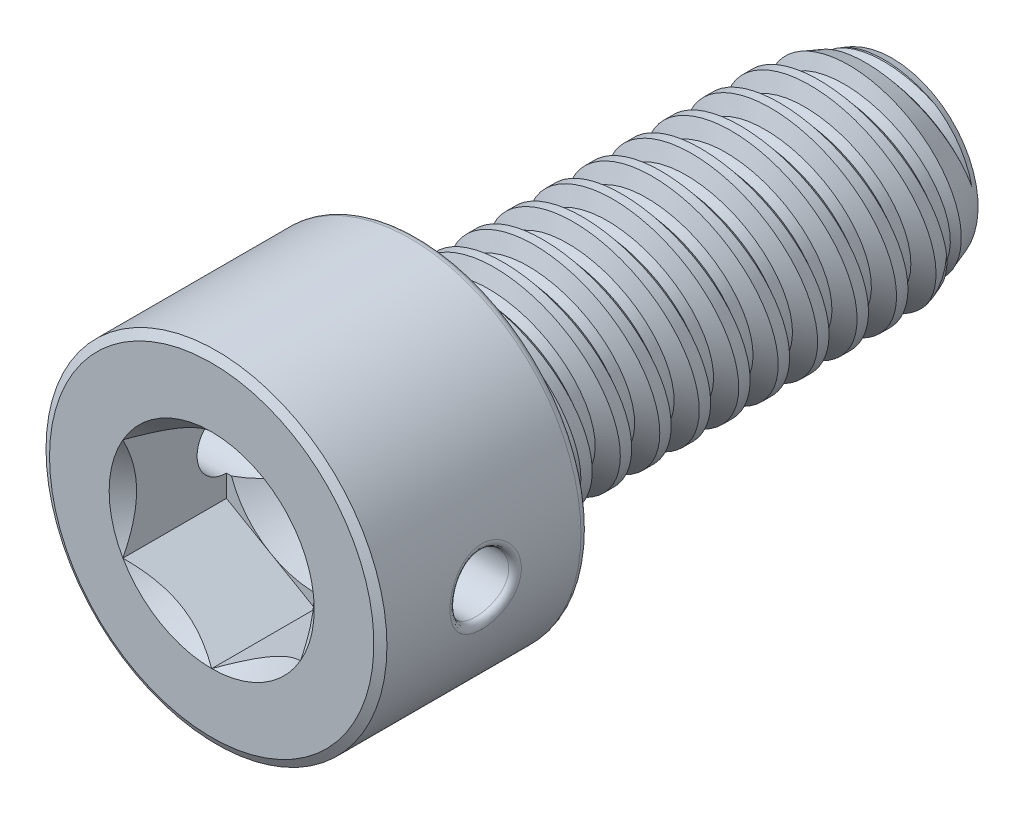
from build123d import *

# Parameters (mm, degrees)
SKETCH1_W               = 9.525
SKETCH1_H               = 2.0828
LPATTERN1_COUNT         = 12
LPATTERN1_PITCH         = 0.79375
LPATTERN2_COUNT         = 2
LPATTERN2_PITCH         = 0.79375
SKETCH4_R               = 3.429
EXTRUDE1_DEPTH          = 4.1656
CUT_EXTRUDE6_DEPTH      = 11.688391315
CUT_EXTRUDE6_DEPTH_BACK = 11.688391315
SKETCH9_R               = 0.59055
FILLET1_R               = 0.166624
CHAMFER1_SIZE           = 0.166624
CHAMFER1_SIZE2          = 0.096200411
CUT_EXTRUDE1_DEPTH      = 2.0828
SKETCH8_R               = 1.7859375
CUT_EXTRUDE5_DEPTH      = 0.694266667
CUT_EXTRUDE5_DRAFT      = -60
FILLET2_R               = 0.127


with BuildPart() as part:
    # Sketch1 → Revolve1 (revolve)
    with BuildSketch(Plane(origin=(0, 0, 0), x_dir=(0, 0, -1), z_dir=(1, 0, 0))):
        with Locations((4.7625, 1.0414)):
            Rectangle(SKETCH1_W, SKETCH1_H)
    revolve(axis=Axis((0, 0, 0), (0, 0, 1)))

    # Sketch2 → Cut-Revolve1 (revolve, cut)
    with BuildSketch(Plane(origin=(0, 0, 0), x_dir=(0, 0, -1), z_dir=(1, 0, 0)), mode=Mode.PRIVATE) as cut_revolve1_sk:
        Polygon((0.097465104, 2.101371857), (0.779720832, 2.231374854), (0.61647657, 1.762908932), (0.421546362, 1.725765218), align=None)
    cut_revolve1 = revolve(cut_revolve1_sk.sketch.rotate(Axis((0, -0.162231854, 0), (0, 0.18718091792156116, -0.9823254572523517)), 180), axis=Axis((0, -0.162231854, 0), (0, 0.18718091792156116, -0.9823254572523517)), mode=Mode.SUBTRACT)

    # Sketch3 → Cut-Revolve2 (revolve, cut)
    with BuildSketch(Plane(origin=(0, 0, 0), x_dir=(0, 0, -1), z_dir=(1, 0, 0))):
        Polygon((9.525, 1.725765218), (8.544055, 2.0828), (9.525, 2.0828), align=None)
    revolve(axis=Axis((0, 0, -8.544055), (0, 0, 1)), mode=Mode.SUBTRACT)

    # LPattern1: Cut-Revolve1 ×12
    with Locations(*[(0, 0, -i * LPATTERN1_PITCH) for i in range(1, LPATTERN1_COUNT)]):
        add(cut_revolve1, mode=Mode.SUBTRACT)

    # LPattern2: Cut-Revolve1 ×2
    with Locations(*[(0, 0, i * LPATTERN2_PITCH) for i in range(1, LPATTERN2_COUNT)]):
        add(cut_revolve1, mode=Mode.SUBTRACT)

    # Sketch4 → Extrude1 (add)
    with BuildSketch(Plane.XY):
        Circle(SKETCH4_R)
    extrude(amount=EXTRUDE1_DEPTH)

    # Sketch9 → Cut-Extrude6 (cut, two sides: drawn at the far end of the back side and taken through both)
    with BuildSketch(Plane(origin=(0, 0, 0), x_dir=(0, 0, -1), z_dir=(1, 0, 0)).offset(-CUT_EXTRUDE6_DEPTH_BACK)):
        with Locations(Location((-2.0828, 0, 0), (0, 0, 180))):
            Circle(SKETCH9_R)
    extrude(amount=CUT_EXTRUDE6_DEPTH + CUT_EXTRUDE6_DEPTH_BACK, mode=Mode.SUBTRACT)

    # Fillet1
    fillet1_edges = [part.edges().sort_by_distance(p)[0] for p in [
        (-3.429, 0, 0),
    ]]
    fillet(fillet1_edges, radius=FILLET1_R)

    # Chamfer1
    chamfer1_edges = [part.edges().sort_by_distance(p)[0] for p in [
        (-3.429, 0, 4.1656),
    ]]
    chamfer1_side = [part.faces().sort_by_distance(p)[0] for p in [
        (0, 0, 4.1656),
    ]]
    chamfer(chamfer1_edges, length=CHAMFER1_SIZE, length2=CHAMFER1_SIZE2, reference=chamfer1_side[0])

    # Sketch6 → Cut-Extrude1 (cut)
    with BuildSketch(Plane.XY.offset(4.1656)):
        Polygon((0, -2.062222993), (1.7859375, -1.031111496), (1.7859375, 1.031111496), (0, 2.062222993), (-1.7859375, 1.031111496), (-1.7859375, -1.031111496), align=None)
    extrude(amount=-CUT_EXTRUDE1_DEPTH, mode=Mode.SUBTRACT)

    # Cut-Extrude4 cone 1 section (through the dimple's axis) → Cut-Extrude4 (revolve, cut)
    with BuildSketch(Plane(origin=(0, 0, 4.1656), x_dir=(0, -1, 0), z_dir=(1, 0, 0))):
        Polygon((0, 0), (2.062222993, 0), (0, 2.062222993), align=None)
    revolve(axis=Axis((0, 0, 4.1656), (0, 0, -1)), mode=Mode.SUBTRACT)


with BuildPart() as cut_extrude5_tool:
    # Sketch8 → Cut-Extrude5 (with draft: the straight prism first)
    with BuildSketch(Plane.XY.offset(2.0828)):
        Circle(SKETCH8_R)
    extrude(amount=-CUT_EXTRUDE5_DEPTH)
    # Cut-Extrude5: the draft: its side faces are tilted about the plane it starts from
    cut_extrude5_sides = [cut_extrude5_tool.faces().sort_by_distance(p)[0] for p in [
        (-1.7859375, 0, 1.735666667),
    ]]
    draft(cut_extrude5_sides, Plane.XY.offset(2.0828), CUT_EXTRUDE5_DRAFT)


with BuildPart() as part_1:
    add(part.part)

    # Cut-Extrude5: cut by cut_extrude5_tool
    add(cut_extrude5_tool.part, mode=Mode.SUBTRACT)

    # Fillet2
    fillet2_edges = [part_1.edges().sort_by_distance(p)[0] for p in [
        (3.377764305, 0.59055, 2.0828),
        (-3.429, 0, 1.49225),
    ]]
    fillet(fillet2_edges, radius=FILLET2_R)


solid = part_1.part
